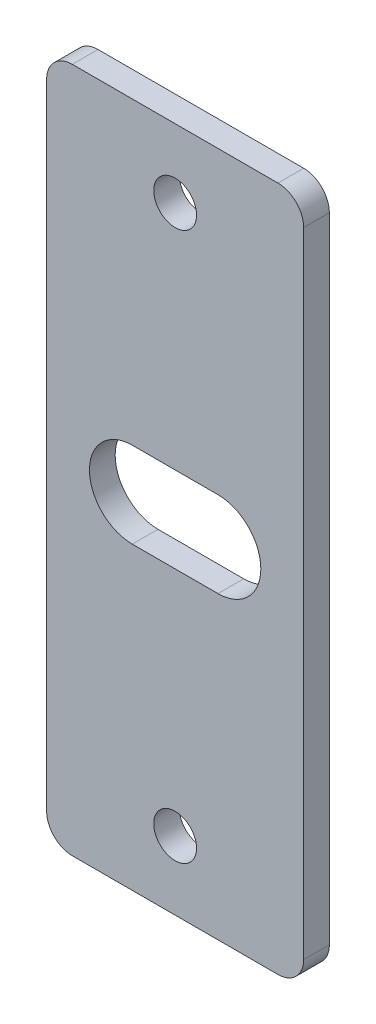
from build123d import *

# Parameters (mm, degrees)
EXTRUDE_1_DEPTH     = 3
SKETCH_2_R          = 2.5
CUT_EXTRUDE_1_DEPTH = 82.449370777


with BuildPart() as part:
    # 草图1 → 凸台-拉伸1 (new body)
    with BuildSketch(Plane.XY):
        with BuildLine():
            Line((-12, 0), (12, 0))
            ThreePointArc((12, 0), (14.121320344, 0.878679656), (15, 3))
            Line((15, 3), (15, 77))
            ThreePointArc((15, 77), (14.121320344, 79.121320344), (12, 80))
            Line((12, 80), (-12, 80))
            ThreePointArc((-12, 80), (-14.121320344, 79.121320344), (-15, 77))
            Line((-15, 77), (-15, 3))
            ThreePointArc((-15, 3), (-14.121320344, 0.878679656), (-12, 0))
        make_face()
    extrude(amount=EXTRUDE_1_DEPTH)

    # 草图2 → 切除-拉伸1 (cut, through all)
    with BuildSketch(Plane.XY):
        with Locations((0, 8)):
            Circle(SKETCH_2_R)
        with Locations((0, 72)):
            Circle(SKETCH_2_R)
        with BuildLine():
            Line((-5, 35), (5, 35))
            ThreePointArc((5, 35), (10, 40), (5, 45))
            Line((5, 45), (-5, 45))
            ThreePointArc((-5, 45), (-10, 40), (-5, 35))
        make_face()
    extrude(amount=CUT_EXTRUDE_1_DEPTH, mode=Mode.SUBTRACT)


solid = part.part
